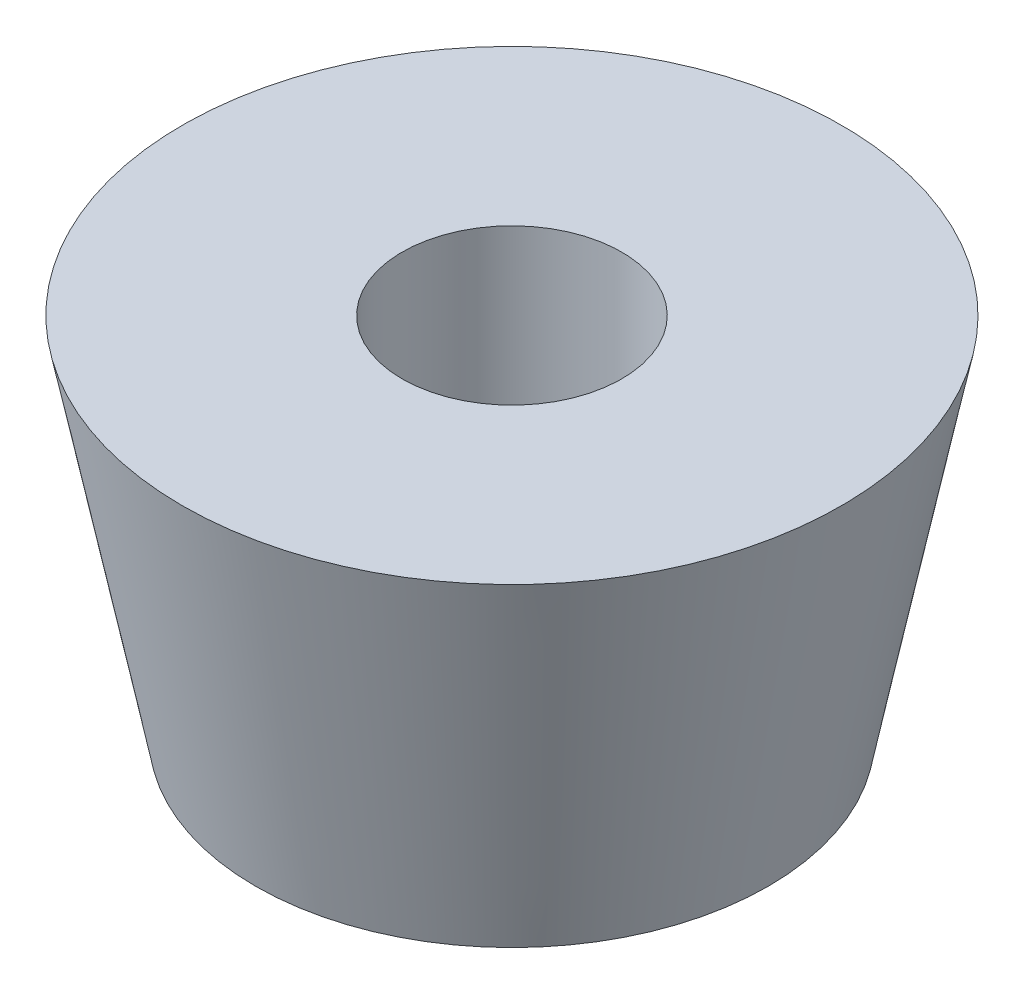
from build123d import *


with BuildPart() as part:
    # Sketch2 → Revolve1 (revolve)
    with BuildSketch(Plane(origin=(0, 0, 0), x_dir=(0, 0, -1), z_dir=(1, 0, 0)), mode=Mode.PRIVATE) as revolve1_sk:
        Polygon((1.5, 0), (1.5, -5), (3.5, -5), (4.5, 0), align=None)
    revolve(revolve1_sk.sketch.rotate(Axis((0, 0, 0), (0, -1, 0)), 180), axis=Axis((0, 0, 0), (0, -1, 0)))


solid = part.part
